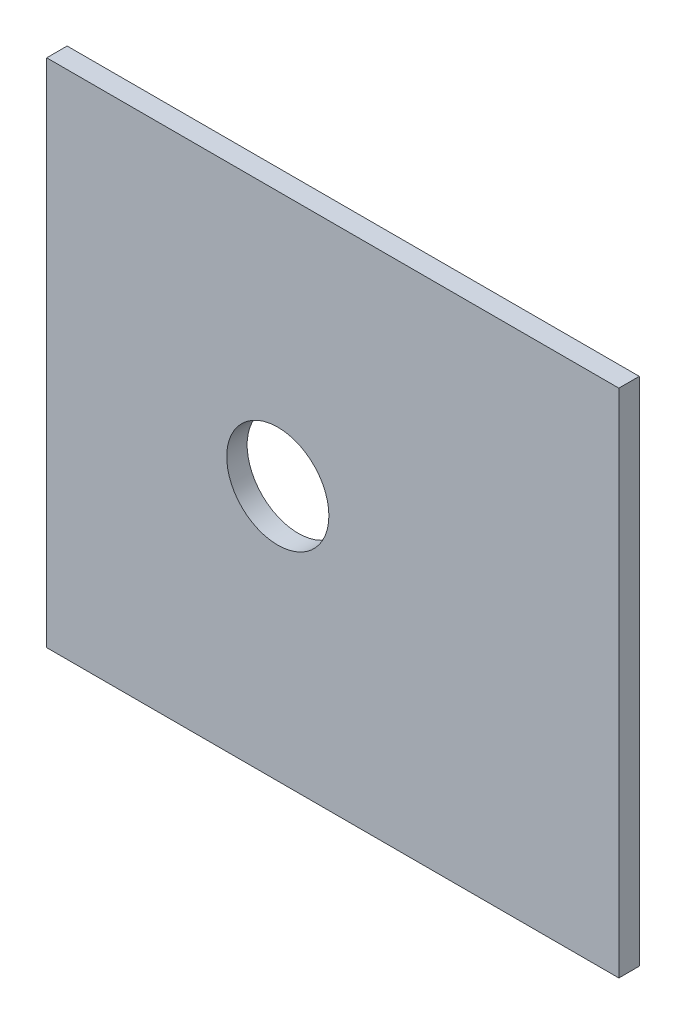
from build123d import *

# Parameters (mm, degrees)
SKETCH1_W           = 112
SKETCH1_H           = 100
SKETCH1_R           = 10
BOSS_EXTRUDE1_DEPTH = 4


with BuildPart() as part:
    # Sketch1 → Boss-Extrude1 (new body)
    with BuildSketch(Plane.XY):
        Rectangle(SKETCH1_W, SKETCH1_H)
        with Locations((-10.763375575, 0)):
            Circle(SKETCH1_R, mode=Mode.SUBTRACT)
    extrude(amount=BOSS_EXTRUDE1_DEPTH)


solid = part.part
